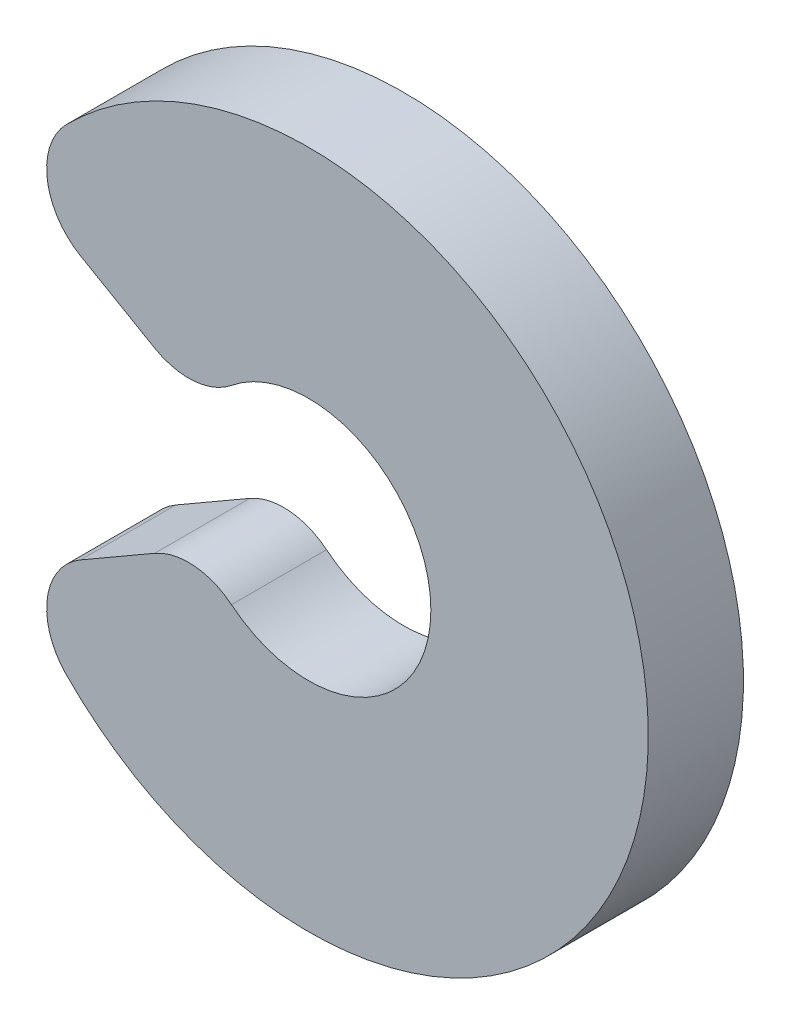
from build123d import *

# Parameters (mm, degrees)
BOSS_EXTRU_1_DEPTH = 1.4
CONG_1_R           = 1


with BuildPart() as part:
    # Esquisse1 → Boss.-Extru.1 (new body)
    with BuildSketch(Plane(origin=(0, 0, 0), x_dir=(0, 1, 0), z_dir=(0, 0, 1))):
        with BuildLine():
            ThreePointArc((1.8, 0), (-0.9, -1.558845727), (-0.9, 1.558845727))
            Line((-0.9, 1.558845727), (-2.5, 4.330127019))
            ThreePointArc((-2.5, 4.330127019), (-2.5, -4.330127019), (5, 0))
            ThreePointArc((5, 0), (4.330127019, 2.5), (2.5, 4.330127019))
            Line((2.5, 4.330127019), (0.9, 1.558845727))
            ThreePointArc((0.9, 1.558845727), (1.558845727, 0.9), (1.8, 0))
        make_face()
    extrude(amount=BOSS_EXTRU_1_DEPTH)

    # Congé1
    cong_1_edges = [part.edges().sort_by_distance(p)[0] for p in [
        (-1.558845727, -0.9, 0.7),
        (-1.558845727, 0.9, 0.7),
        (-4.330127019, 2.5, 0.7),
        (-4.330127019, -2.5, 0.7),
    ]]
    fillet(cong_1_edges, radius=CONG_1_R)


solid = part.part
